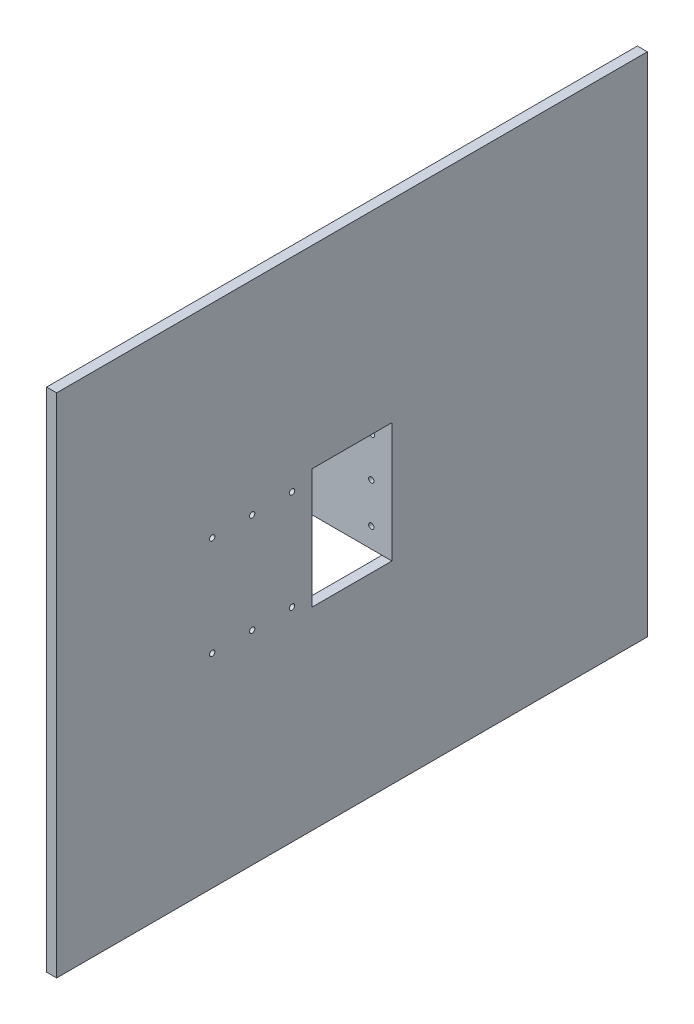
from build123d import *

# Parameters (mm, degrees)
SKETCH_1_W      = 180
SKETCH_1_H      = 180
SKETCH_1_R      = 4
EXTRUDE_1_DEPTH = 15
SKETCH_9_W      = 887.558239328
SKETCH_9_H      = 761.432182166
SKETCH_9_R      = 4
SKETCH_9_W_2    = 120
SKETCH_9_H_2    = 180
EXTRUDE_2_DEPTH = 15


with BuildPart() as part:
    # 草图1 → 凸台-拉伸1 (new body)
    with BuildSketch(Plane.XY):
        Rectangle(SKETCH_1_W, SKETCH_1_H)
        with Locations((-75, 60)):
            Circle(SKETCH_1_R, mode=Mode.SUBTRACT)
        with Locations((-74.035625505, 0)):
            Circle(SKETCH_1_R, mode=Mode.SUBTRACT)
        with Locations((-74.035625505, -60)):
            Circle(SKETCH_1_R, mode=Mode.SUBTRACT)
        with Locations(Location((74.035625505, -60, 0), (0, 0, 180))):
            Circle(SKETCH_1_R, mode=Mode.SUBTRACT)
        with Locations(Location((74.035625505, 0, 0), (0, 0, 180))):
            Circle(SKETCH_1_R, mode=Mode.SUBTRACT)
        with Locations(Location((75, 60, 0), (0, 0, 180))):
            Circle(SKETCH_1_R, mode=Mode.SUBTRACT)
    extrude(amount=EXTRUDE_1_DEPTH)

    # 草图9 → 凸台-拉伸2 (add)
    with BuildSketch(Plane(origin=(90, 0, 0), x_dir=(0, 0, -1), z_dir=(1, 0, 0))):
        with Locations((-75, 0)):
            Rectangle(SKETCH_9_W, SKETCH_9_H)
        with Locations((-165, 75)):
            Circle(SKETCH_9_R, mode=Mode.SUBTRACT)
        with Locations((-225, 75)):
            Circle(SKETCH_9_R, mode=Mode.SUBTRACT)
        with Locations((-285, 75)):
            Circle(SKETCH_9_R, mode=Mode.SUBTRACT)
        with Locations(Location((-285, -75, 0), (0, 0, 180))):
            Circle(SKETCH_9_R, mode=Mode.SUBTRACT)
        with Locations(Location((-225, -75, 0), (0, 0, 180))):
            Circle(SKETCH_9_R, mode=Mode.SUBTRACT)
        with Locations(Location((-165, -75, 0), (0, 0, 180))):
            Circle(SKETCH_9_R, mode=Mode.SUBTRACT)
        with Locations((-75, 0)):
            Rectangle(SKETCH_9_W_2, SKETCH_9_H_2, mode=Mode.SUBTRACT)
    extrude(amount=EXTRUDE_2_DEPTH)


solid = part.part
